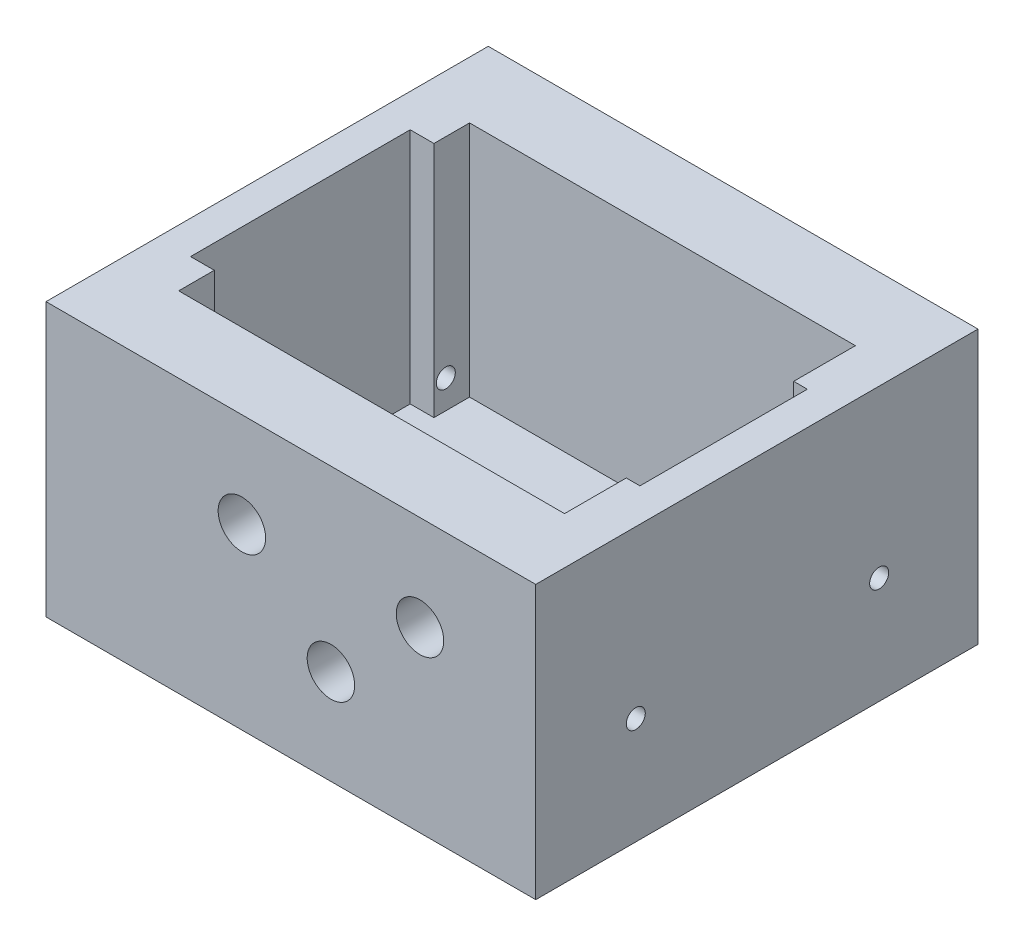
from build123d import *

# Parameters (mm, degrees)
SKETCH1_W           = 41.25
SKETCH1_H           = 37.25
BOSS_EXTRUDE1_DEPTH = 23
CUT_EXTRUDE1_DEPTH  = 20
SKETCH3_R           = 0.8
CUT_EXTRUDE2_DEPTH  = 3.95
SKETCH4_R           = 0.8
CUT_EXTRUDE3_DEPTH  = 4.8
SKETCH5_R           = 2
CUT_EXTRUDE4_DEPTH  = 5.5


with BuildPart() as part:
    # Sketch1 → Boss-Extrude1 (new body)
    with BuildSketch(Plane(origin=(0, 0, 0), x_dir=(1, 0, 0), z_dir=(0, 1, 0))):
        with Locations((20.625, 18.625)):
            Rectangle(SKETCH1_W, SKETCH1_H)
    extrude(amount=BOSS_EXTRUDE1_DEPTH)

    # Sketch2 → Cut-Extrude1 (cut)
    with BuildSketch(Plane(origin=(0, 23, 0), x_dir=(1, 0, 0), z_dir=(0, 1, 0))):
        Polygon((37.3, 30.875), (4.8, 30.875), (4.8, 27.875), (2.8, 27.875), (2.8, 9.375), (4.8, 9.375), (4.8, 6.375), (37.3, 6.375), (37.3, 11.575), (38.45, 11.575), (38.45, 25.675), (37.3, 25.675), align=None)
    extrude(amount=-CUT_EXTRUDE1_DEPTH, mode=Mode.SUBTRACT)

    # Sketch3 → Cut-Extrude2 (cut)
    with BuildSketch(Plane.ZY.offset(-37.3)):
        with Locations((-28.925, 9)):
            Circle(SKETCH3_R)
        with Locations((-8.425, 9)):
            Circle(SKETCH3_R)
    extrude(amount=-CUT_EXTRUDE2_DEPTH, mode=Mode.SUBTRACT)

    # Sketch4 → Cut-Extrude3 (cut)
    with BuildSketch(Plane(origin=(4.8, 0, 0), x_dir=(0, 0, -1), z_dir=(1, 0, 0))):
        with Locations((28.875, 5.4)):
            Circle(SKETCH4_R)
        with Locations((8.375, 5.4)):
            Circle(SKETCH4_R)
    extrude(amount=-CUT_EXTRUDE3_DEPTH, mode=Mode.SUBTRACT)

    # Sketch5 → Cut-Extrude4 (cut)
    with BuildSketch(Plane.XY):
        with Locations((16.5, 15)):
            Circle(SKETCH5_R)
        with Locations((31.5, 15)):
            Circle(SKETCH5_R)
        with Locations((24, 8)):
            Circle(SKETCH5_R)
    cut_extrude4 = extrude(amount=-CUT_EXTRUDE4_DEPTH, mode=Mode.SUBTRACT)

    # Mirror1: Cut-Extrude4 across plane
    add(cut_extrude4.mirror(Plane.XY.offset(-18.625)), mode=Mode.SUBTRACT)


solid = part.part
